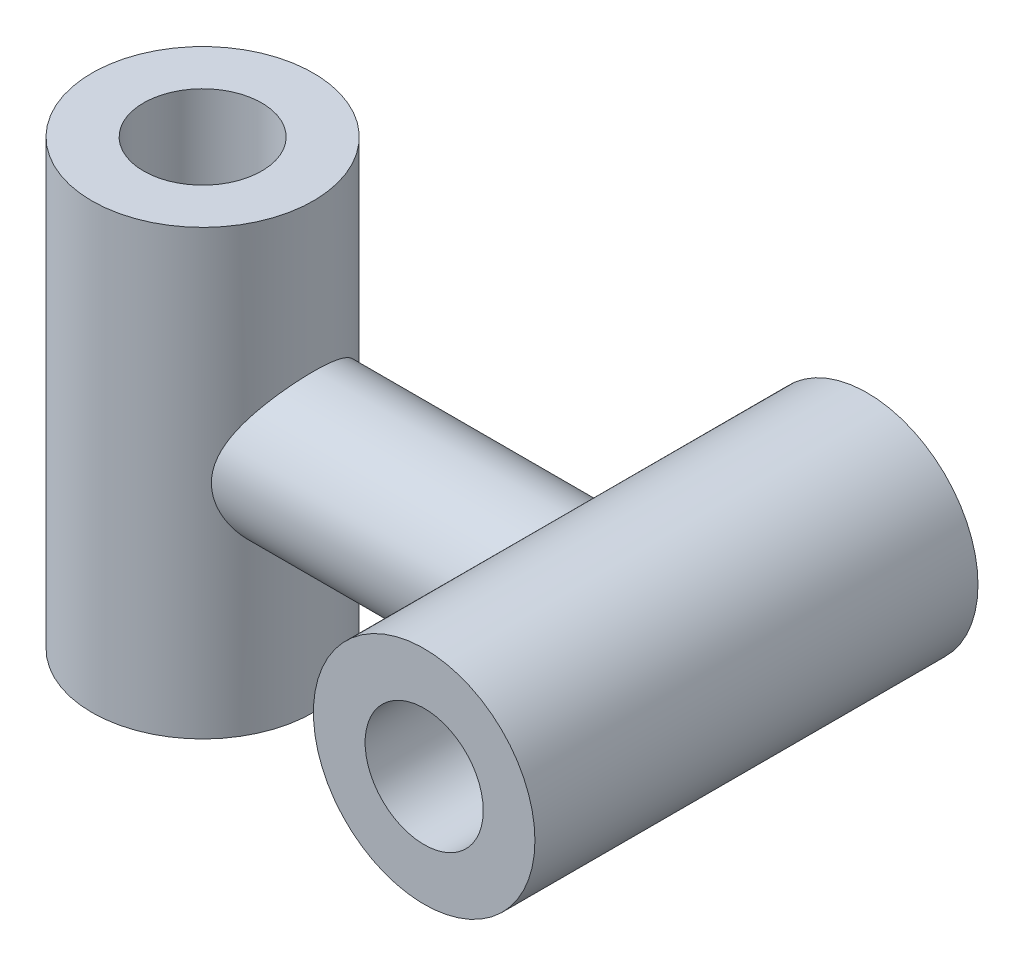
from build123d import *
from build123d.topology import SkipClean

# Parameters (mm, degrees)
SKETCH1_R                            = 15
SKETCH1_R_2                          = 8
BOSS_EXTRUDE1_DEPTH                  = 30
SKETCH3_R                            = 15
SKETCH3_R_2                          = 8
BOSS_EXTRUDE3_DEPTH                  = 30
BOSS_EXTRUDE4_REACH                  = 75.485
BOSS_EXTRUDE4_END_RADIUS             = 15
SKETCH4_R                            = 10
BOSS_EXTRUDE4_DIRECTION_2_REACH      = 75.485
BOSS_EXTRUDE4_DIRECTION_2_END_RADIUS = 15


with BuildPart() as part:
    # Sketch1 → Boss-Extrude1 (new, symmetric)
    with BuildSketch(Plane(origin=(0, 0, 0), x_dir=(1, 0, 0), z_dir=(0, 1, 0))):
        with Locations(Location((0, 0, 0), (0, 0, 270))):
            Circle(SKETCH1_R)
        with Locations(Location((0, 0, 0), (0, 0, 270))):
            Circle(SKETCH1_R_2, mode=Mode.SUBTRACT)
    extrude(amount=BOSS_EXTRUDE1_DEPTH, both=True)



with BuildPart() as body_2:
    # Sketch3 → Boss-Extrude3 (new, symmetric)
    with BuildSketch(Plane.XY):
        with Locations((60, 0)):
            Circle(SKETCH3_R)
        with Locations((60, 0)):
            Circle(SKETCH3_R_2, mode=Mode.SUBTRACT)
    extrude(amount=BOSS_EXTRUDE3_DEPTH, both=True)


with BuildPart() as part_1:
    add(part.part)

    add(body_2.part)  # Boss-Extrude4 merges body 2
    # Boss-Extrude4: up to this cylinder (the profile starts outside it)
    boss_extrude4_end = Plane(origin=(60, 0, 0), z_dir=(0, 0, -1)) * Cylinder(BOSS_EXTRUDE4_END_RADIUS, 181.97, mode=Mode.PRIVATE)
    # Sketch4 → Boss-Extrude4 (add, up to the surface)
    with BuildSketch(Plane(origin=(15, 0, 0), x_dir=(0, 0, -1), z_dir=(1, 0, 0)), mode=Mode.PRIVATE) as boss_extrude4_sk1:
        with Locations(Location((0, 0, 0), (0, 0, 180))):
            Circle(SKETCH4_R)
    boss_extrude4_tool1 = extrude(boss_extrude4_sk1.sketch, amount=BOSS_EXTRUDE4_REACH, mode=Mode.PRIVATE) - boss_extrude4_end
    add(boss_extrude4_tool1.solids().sort_by_distance((15, 0, 0))[0])

    # Boss-Extrude4 direction 2: up to this cylinder (the profile starts outside it)
    with SkipClean():  # the faces are left unmerged after this step: merging them gives an invalid solid
        boss_extrude4_direction_2_end = Plane(origin=(0, 0, 0), z_dir=(0, -1, 0)) * Cylinder(BOSS_EXTRUDE4_DIRECTION_2_END_RADIUS, 181.97, mode=Mode.PRIVATE)
        # Sketch4 → Boss-Extrude4 direction 2 (add, up to the surface)
        with BuildSketch(Plane(origin=(15, 0, 0), x_dir=(0, 0, -1), z_dir=(1, 0, 0)), mode=Mode.PRIVATE) as boss_extrude4_direction_2_sk1:
            with Locations(Location((0, 0, 0), (0, 0, 180))):
                Circle(SKETCH4_R)
        boss_extrude4_direction_2_tool1 = extrude(boss_extrude4_direction_2_sk1.sketch, amount=-BOSS_EXTRUDE4_DIRECTION_2_REACH, mode=Mode.PRIVATE) - boss_extrude4_direction_2_end
        add(boss_extrude4_direction_2_tool1.solids().sort_by_distance((15, 0, 0))[0])
        add(boss_extrude4_direction_2_tool1.solids().sort_by_distance((15, 0, 0))[1])


solid = part_1.part
